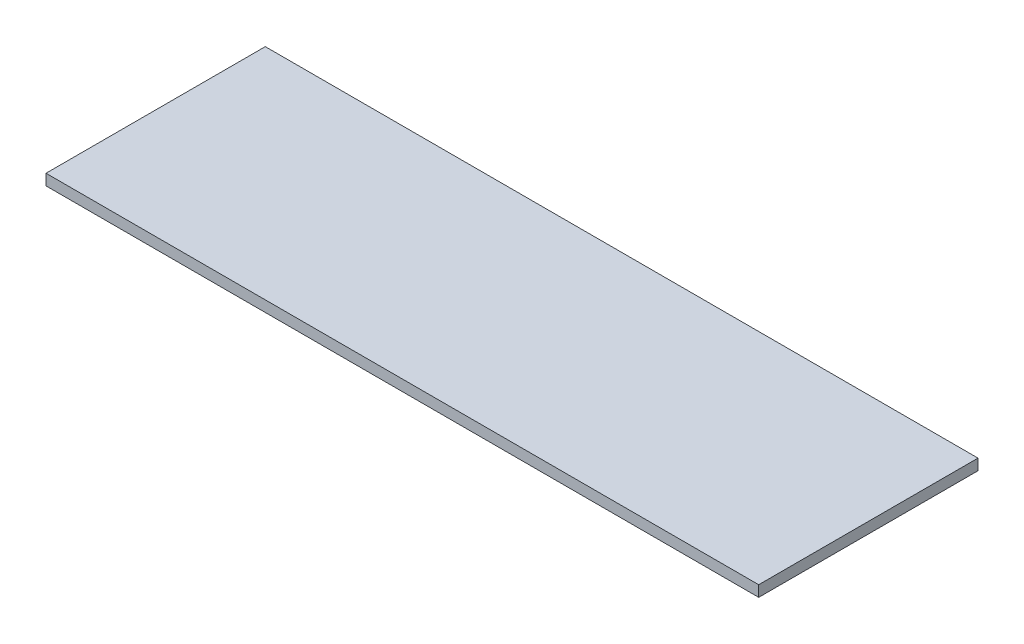
from build123d import *

# Parameters (mm, degrees)
CROQUIS1_W              = 1170
CROQUIS1_H              = 360
SALIENTE_EXTRUIR1_DEPTH = 18


with BuildPart() as part:
    # Croquis1 → Saliente-Extruir1 (new body)
    with BuildSketch(Plane(origin=(0, 0, 0), x_dir=(1, 0, 0), z_dir=(0, 1, 0))):
        Rectangle(CROQUIS1_W, CROQUIS1_H)
    extrude(amount=SALIENTE_EXTRUIR1_DEPTH)


solid = part.part
